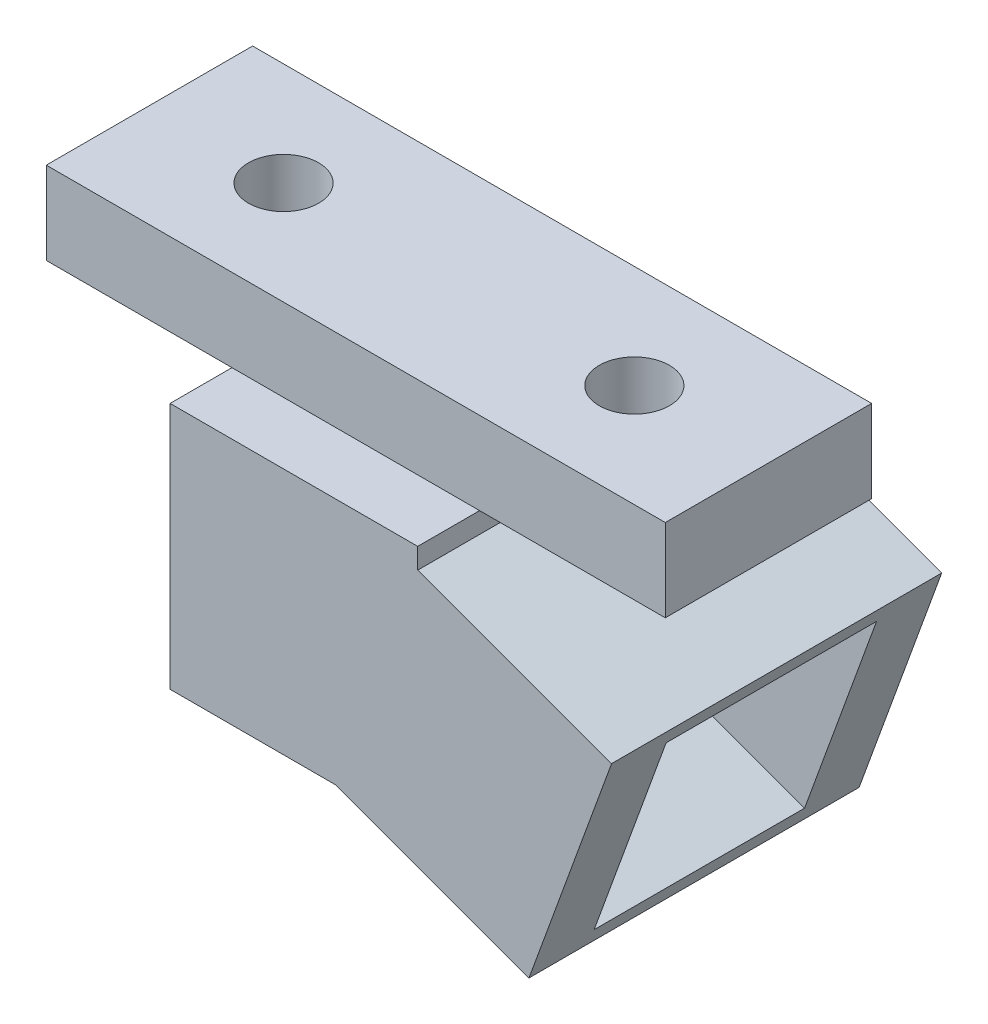
from build123d import *

# Parameters (mm, degrees)
SKETCH_1_W          = 15
SKETCH_1_H          = 5
SKETCH_1_R          = 0.85
EXTRUDE_1_DEPTH     = 2
SKETCH_2_W          = 6
SKETCH_2_H          = 8
EXTRUDE_3_DEPTH     = 6
CUT_EXTRUDE_2_DEPTH = 8
SKETCH_7_W          = 5.1
SKETCH_7_H          = 5.1
CUT_EXTRUDE_3_DEPTH = 2
SKETCH_10_W         = 8
SKETCH_10_H         = 5.852977749
SKETCH_10_W_2       = 5.1
SKETCH_10_H_2       = 5.1
EXTRUDE_4_DEPTH     = 5


with BuildPart() as part:
    # 草图1 → 凸台-拉伸1 (new body)
    with BuildSketch(Plane(origin=(0, 0, 0), x_dir=(1, 0, 0), z_dir=(0, 1, 0))):
        with Locations((7.5, 2.5)):
            Rectangle(SKETCH_1_W, SKETCH_1_H)
        with Locations(Location((3.25, 2.5, 0), (0, 0, 270))):
            Circle(SKETCH_1_R, mode=Mode.SUBTRACT)
        with Locations(Location((11.75, 2.5, 0), (0, 0, 90))):
            Circle(SKETCH_1_R, mode=Mode.SUBTRACT)
    extrude(amount=EXTRUDE_1_DEPTH)

    # 草图2 → 凸台-拉伸3 (add)
    with BuildSketch(Plane.XZ):
        with Locations((7.5, -2.5)):
            Rectangle(SKETCH_2_W, SKETCH_2_H)
    extrude(amount=EXTRUDE_3_DEPTH)

    # 草图6 → 切除-拉伸2 (cut)
    with BuildSketch(Plane(origin=(0, 0, -6.5), x_dir=(-1, 0, 0), z_dir=(0, 0, -1))):
        Polygon((-10.5, -0.5), (-10.5, -6), (-8.498163712, -6), align=None)
    extrude(amount=-CUT_EXTRUDE_2_DEPTH, mode=Mode.SUBTRACT)

    # 草图7 → 切除-拉伸3 (cut)
    with BuildSketch(Plane(origin=(9.432430229, -3.43312384, 0), x_dir=(0, 0, -1), z_dir=(0.9396926207859104, -0.3420201433256631, 0))):
        with Locations((2.5, 0.19487632)):
            Rectangle(SKETCH_7_W, SKETCH_7_H)
    extrude(amount=-CUT_EXTRUDE_3_DEPTH, mode=Mode.SUBTRACT)

    # 草图10 → 凸台-拉伸4 (add)
    with BuildSketch(Plane(origin=(9.432430229, -3.43312384, 0), x_dir=(0, 0, -1), z_dir=(0.9396926207859104, -0.3420201433256631, 0))):
        with Locations((2.5, 0.19487632)):
            Rectangle(SKETCH_10_W, SKETCH_10_H)
        with Locations((2.5, 0.19487632)):
            Rectangle(SKETCH_10_W_2, SKETCH_10_H_2, mode=Mode.SUBTRACT)
    extrude(amount=EXTRUDE_4_DEPTH)


solid = part.part
